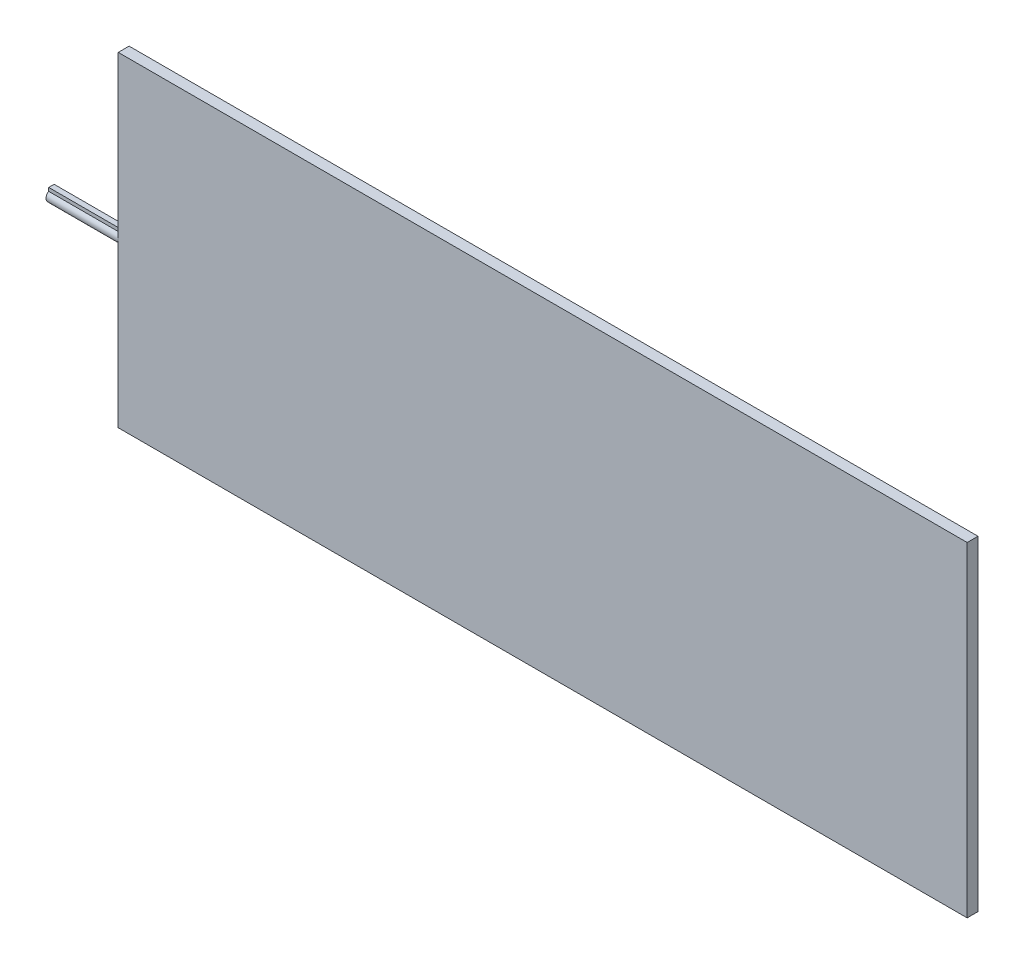
from build123d import *

# Parameters (mm, degrees)
SKETCH_1_W      = 235
SKETCH_1_H      = 90
EXTRUDE_1_DEPTH = 3
EXTRUDE_2_DEPTH = 20


with BuildPart() as part:
    # 草图1 → 凸台-拉伸1 (new body)
    with BuildSketch(Plane.XY):
        Rectangle(SKETCH_1_W, SKETCH_1_H)
    extrude(amount=EXTRUDE_1_DEPTH)

    # 草图2 → 凸台-拉伸2 (add)
    with BuildSketch(Plane.ZY.offset(117.5)):
        with BuildLine():
            Line((0.75, 2.25), (2.25, 2.25))
            Line((2.25, 2.25), (2.25, 1.299038106))
            ThreePointArc((2.25, 1.299038106), (1.5, -1.5), (0.75, 1.299038106))
            Line((0.75, 1.299038106), (0.75, 2.25))
        make_face()
    extrude(amount=EXTRUDE_2_DEPTH)


solid = part.part
